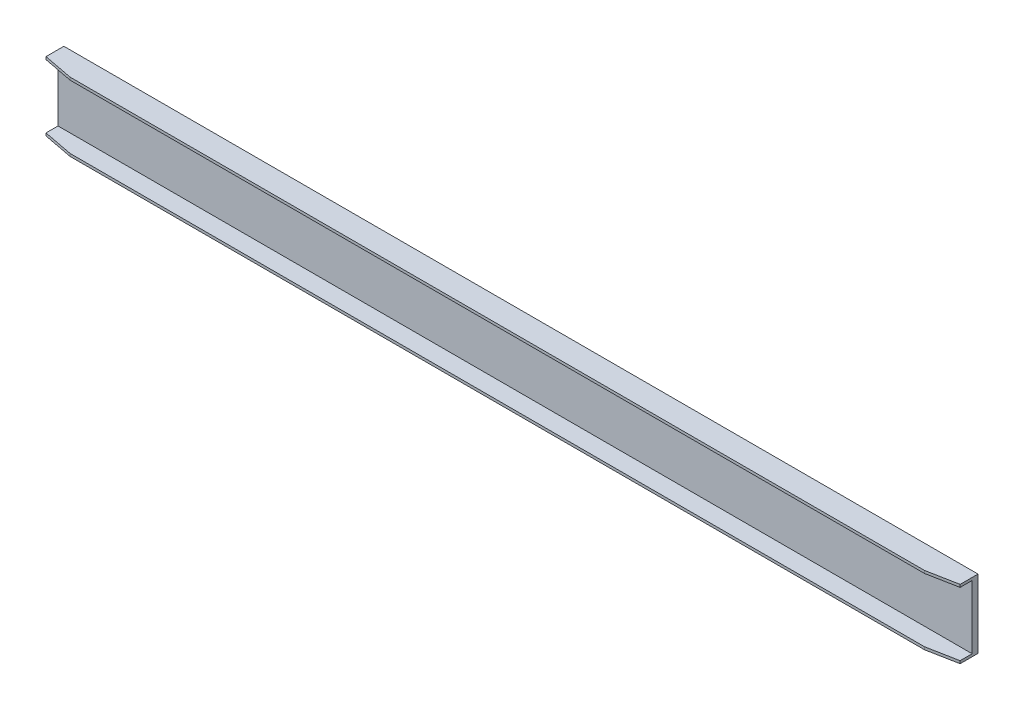
from build123d import *

# Parameters (mm, degrees)
SKETCH_1_W          = 3990
SKETCH_1_H          = 300
SKETCH_1_R          = 13
SKETCH_1_R_2        = 11.5
EXTRUDE_1608_DEPTH  = 25.5
SKETCH_2_W          = 3990
SKETCH_2_H          = 11.5
EXTRUDE_1_DEPTH     = 77.5
SKETCH_3_W          = 70
SKETCH_3_H          = 230
EXTRUDE_2_DEPTH     = 16
SKETCH_4_R          = 13
CUT_EXTRUDE_1_DEPTH = 2003.131676489
CUT_EXTRUDE_2_DEPTH = 2021.057919962
SKETCH_6_W          = 3990
SKETCH_6_H          = 277
EXTRUDE_3_DEPTH     = 25.5
SKETCH_7_W          = 70
SKETCH_7_H          = 230
EXTRUDE_4_DEPTH     = 16


with BuildPart() as part:
    # 草图1 → Extrude 1608 (new body)
    with BuildSketch(Plane.XY):
        Rectangle(SKETCH_1_W, SKETCH_1_H)
        with Locations((1940, 80)):
            Circle(SKETCH_1_R, mode=Mode.SUBTRACT)
        with Locations((1860, 80)):
            Circle(SKETCH_1_R, mode=Mode.SUBTRACT)
        with Locations((1780, 80)):
            Circle(SKETCH_1_R, mode=Mode.SUBTRACT)
        with Locations((1700, 80)):
            Circle(SKETCH_1_R, mode=Mode.SUBTRACT)
        with Locations((1540, 80)):
            Circle(SKETCH_1_R_2, mode=Mode.SUBTRACT)
        with Locations((1380, 80)):
            Circle(SKETCH_1_R_2, mode=Mode.SUBTRACT)
        with Locations((1220, 80)):
            Circle(SKETCH_1_R_2, mode=Mode.SUBTRACT)
        with Locations((1060, 80)):
            Circle(SKETCH_1_R_2, mode=Mode.SUBTRACT)
        with Locations((980, 80)):
            Circle(SKETCH_1_R_2, mode=Mode.SUBTRACT)
        with Locations((820, 80)):
            Circle(SKETCH_1_R_2, mode=Mode.SUBTRACT)
        with Locations((740, 80)):
            Circle(SKETCH_1_R_2, mode=Mode.SUBTRACT)
        with Locations((580, 80)):
            Circle(SKETCH_1_R_2, mode=Mode.SUBTRACT)
        with Locations((980, 0)):
            Circle(SKETCH_1_R_2, mode=Mode.SUBTRACT)
        with Locations((1060, 0)):
            Circle(SKETCH_1_R_2, mode=Mode.SUBTRACT)
        with Locations((820, 0)):
            Circle(SKETCH_1_R_2, mode=Mode.SUBTRACT)
        with Locations((740, 0)):
            Circle(SKETCH_1_R_2, mode=Mode.SUBTRACT)
        with Locations((580, 0)):
            Circle(SKETCH_1_R_2, mode=Mode.SUBTRACT)
        with Locations((1220, 0)):
            Circle(SKETCH_1_R_2, mode=Mode.SUBTRACT)
        with Locations((1380, 0)):
            Circle(SKETCH_1_R_2, mode=Mode.SUBTRACT)
        with Locations((1540, 0)):
            Circle(SKETCH_1_R_2, mode=Mode.SUBTRACT)
        with Locations((1700, 0)):
            Circle(SKETCH_1_R, mode=Mode.SUBTRACT)
        with Locations((1780, 0)):
            Circle(SKETCH_1_R, mode=Mode.SUBTRACT)
        with Locations((1860, 0)):
            Circle(SKETCH_1_R, mode=Mode.SUBTRACT)
        with Locations((1940, 0)):
            Circle(SKETCH_1_R, mode=Mode.SUBTRACT)
        with Locations((420, 80)):
            Circle(SKETCH_1_R_2, mode=Mode.SUBTRACT)
        with Locations((420, 0)):
            Circle(SKETCH_1_R_2, mode=Mode.SUBTRACT)
        with Locations((300, 0)):
            Circle(SKETCH_1_R_2, mode=Mode.SUBTRACT)
        with Locations((300, 80)):
            Circle(SKETCH_1_R_2, mode=Mode.SUBTRACT)
        with Locations((220, 80)):
            Circle(SKETCH_1_R_2, mode=Mode.SUBTRACT)
        with Locations((220, 0)):
            Circle(SKETCH_1_R_2, mode=Mode.SUBTRACT)
        with Locations((140, 0)):
            Circle(SKETCH_1_R, mode=Mode.SUBTRACT)
        with Locations((140, 80)):
            Circle(SKETCH_1_R, mode=Mode.SUBTRACT)
        with Locations((60, 80)):
            Circle(SKETCH_1_R, mode=Mode.SUBTRACT)
        with Locations((60, 0)):
            Circle(SKETCH_1_R, mode=Mode.SUBTRACT)
        with Locations(Location((1700, -80, 0), (0, 0, 180))):
            Circle(SKETCH_1_R, mode=Mode.SUBTRACT)
        with Locations(Location((1780, -80, 0), (0, 0, 180))):
            Circle(SKETCH_1_R, mode=Mode.SUBTRACT)
        with Locations(Location((1860, -80, 0), (0, 0, 180))):
            Circle(SKETCH_1_R, mode=Mode.SUBTRACT)
        with Locations(Location((1940, -80, 0), (0, 0, 180))):
            Circle(SKETCH_1_R, mode=Mode.SUBTRACT)
        with Locations(Location((580, -80, 0), (0, 0, 180))):
            Circle(SKETCH_1_R_2, mode=Mode.SUBTRACT)
        with Locations(Location((740, -80, 0), (0, 0, 180))):
            Circle(SKETCH_1_R_2, mode=Mode.SUBTRACT)
        with Locations(Location((820, -80, 0), (0, 0, 180))):
            Circle(SKETCH_1_R_2, mode=Mode.SUBTRACT)
        with Locations(Location((980, -80, 0), (0, 0, 180))):
            Circle(SKETCH_1_R_2, mode=Mode.SUBTRACT)
        with Locations(Location((1060, -80, 0), (0, 0, 180))):
            Circle(SKETCH_1_R_2, mode=Mode.SUBTRACT)
        with Locations(Location((1220, -80, 0), (0, 0, 180))):
            Circle(SKETCH_1_R_2, mode=Mode.SUBTRACT)
        with Locations(Location((1380, -80, 0), (0, 0, 180))):
            Circle(SKETCH_1_R_2, mode=Mode.SUBTRACT)
        with Locations(Location((1540, -80, 0), (0, 0, 180))):
            Circle(SKETCH_1_R_2, mode=Mode.SUBTRACT)
        with Locations(Location((220, -80, 0), (0, 0, 180))):
            Circle(SKETCH_1_R_2, mode=Mode.SUBTRACT)
        with Locations(Location((300, -80, 0), (0, 0, 180))):
            Circle(SKETCH_1_R_2, mode=Mode.SUBTRACT)
        with Locations(Location((420, -80, 0), (0, 0, 180))):
            Circle(SKETCH_1_R_2, mode=Mode.SUBTRACT)
        with Locations(Location((60, -80, 0), (0, 0, 180))):
            Circle(SKETCH_1_R, mode=Mode.SUBTRACT)
        with Locations(Location((140, -80, 0), (0, 0, 180))):
            Circle(SKETCH_1_R, mode=Mode.SUBTRACT)
        with Locations((-140, -80)):
            Circle(SKETCH_1_R, mode=Mode.SUBTRACT)
        with Locations((-60, -80)):
            Circle(SKETCH_1_R, mode=Mode.SUBTRACT)
        with Locations((-580, -80)):
            Circle(SKETCH_1_R_2, mode=Mode.SUBTRACT)
        with Locations((-420, -80)):
            Circle(SKETCH_1_R_2, mode=Mode.SUBTRACT)
        with Locations((-300, -80)):
            Circle(SKETCH_1_R_2, mode=Mode.SUBTRACT)
        with Locations((-220, -80)):
            Circle(SKETCH_1_R_2, mode=Mode.SUBTRACT)
        with Locations((-1540, -80)):
            Circle(SKETCH_1_R_2, mode=Mode.SUBTRACT)
        with Locations((-1380, -80)):
            Circle(SKETCH_1_R_2, mode=Mode.SUBTRACT)
        with Locations((-1220, -80)):
            Circle(SKETCH_1_R_2, mode=Mode.SUBTRACT)
        with Locations((-1060, -80)):
            Circle(SKETCH_1_R_2, mode=Mode.SUBTRACT)
        with Locations((-980, -80)):
            Circle(SKETCH_1_R_2, mode=Mode.SUBTRACT)
        with Locations((-820, -80)):
            Circle(SKETCH_1_R_2, mode=Mode.SUBTRACT)
        with Locations((-740, -80)):
            Circle(SKETCH_1_R_2, mode=Mode.SUBTRACT)
        with Locations((-1940, -80)):
            Circle(SKETCH_1_R, mode=Mode.SUBTRACT)
        with Locations((-1860, -80)):
            Circle(SKETCH_1_R, mode=Mode.SUBTRACT)
        with Locations((-1780, -80)):
            Circle(SKETCH_1_R, mode=Mode.SUBTRACT)
        with Locations((-1700, -80)):
            Circle(SKETCH_1_R, mode=Mode.SUBTRACT)
        with Locations(Location((-60, 0, 0), (0, 0, 180))):
            Circle(SKETCH_1_R, mode=Mode.SUBTRACT)
        with Locations(Location((-60, 80, 0), (0, 0, 180))):
            Circle(SKETCH_1_R, mode=Mode.SUBTRACT)
        with Locations(Location((-140, 80, 0), (0, 0, 180))):
            Circle(SKETCH_1_R, mode=Mode.SUBTRACT)
        with Locations(Location((-140, 0, 0), (0, 0, 180))):
            Circle(SKETCH_1_R, mode=Mode.SUBTRACT)
        with Locations(Location((-220, 0, 0), (0, 0, 180))):
            Circle(SKETCH_1_R_2, mode=Mode.SUBTRACT)
        with Locations(Location((-220, 80, 0), (0, 0, 180))):
            Circle(SKETCH_1_R_2, mode=Mode.SUBTRACT)
        with Locations(Location((-300, 80, 0), (0, 0, 180))):
            Circle(SKETCH_1_R_2, mode=Mode.SUBTRACT)
        with Locations(Location((-300, 0, 0), (0, 0, 180))):
            Circle(SKETCH_1_R_2, mode=Mode.SUBTRACT)
        with Locations(Location((-420, 0, 0), (0, 0, 180))):
            Circle(SKETCH_1_R_2, mode=Mode.SUBTRACT)
        with Locations(Location((-420, 80, 0), (0, 0, 180))):
            Circle(SKETCH_1_R_2, mode=Mode.SUBTRACT)
        with Locations(Location((-1940, 0, 0), (0, 0, 180))):
            Circle(SKETCH_1_R, mode=Mode.SUBTRACT)
        with Locations(Location((-1860, 0, 0), (0, 0, 180))):
            Circle(SKETCH_1_R, mode=Mode.SUBTRACT)
        with Locations(Location((-1780, 0, 0), (0, 0, 180))):
            Circle(SKETCH_1_R, mode=Mode.SUBTRACT)
        with Locations(Location((-1700, 0, 0), (0, 0, 180))):
            Circle(SKETCH_1_R, mode=Mode.SUBTRACT)
        with Locations(Location((-1540, 0, 0), (0, 0, 180))):
            Circle(SKETCH_1_R_2, mode=Mode.SUBTRACT)
        with Locations(Location((-1380, 0, 0), (0, 0, 180))):
            Circle(SKETCH_1_R_2, mode=Mode.SUBTRACT)
        with Locations(Location((-1220, 0, 0), (0, 0, 180))):
            Circle(SKETCH_1_R_2, mode=Mode.SUBTRACT)
        with Locations(Location((-580, 0, 0), (0, 0, 180))):
            Circle(SKETCH_1_R_2, mode=Mode.SUBTRACT)
        with Locations(Location((-740, 0, 0), (0, 0, 180))):
            Circle(SKETCH_1_R_2, mode=Mode.SUBTRACT)
        with Locations(Location((-820, 0, 0), (0, 0, 180))):
            Circle(SKETCH_1_R_2, mode=Mode.SUBTRACT)
        with Locations(Location((-1060, 0, 0), (0, 0, 180))):
            Circle(SKETCH_1_R_2, mode=Mode.SUBTRACT)
        with Locations(Location((-980, 0, 0), (0, 0, 180))):
            Circle(SKETCH_1_R_2, mode=Mode.SUBTRACT)
        with Locations(Location((-580, 80, 0), (0, 0, 180))):
            Circle(SKETCH_1_R_2, mode=Mode.SUBTRACT)
        with Locations(Location((-740, 80, 0), (0, 0, 180))):
            Circle(SKETCH_1_R_2, mode=Mode.SUBTRACT)
        with Locations(Location((-820, 80, 0), (0, 0, 180))):
            Circle(SKETCH_1_R_2, mode=Mode.SUBTRACT)
        with Locations(Location((-980, 80, 0), (0, 0, 180))):
            Circle(SKETCH_1_R_2, mode=Mode.SUBTRACT)
        with Locations(Location((-1060, 80, 0), (0, 0, 180))):
            Circle(SKETCH_1_R_2, mode=Mode.SUBTRACT)
        with Locations(Location((-1220, 80, 0), (0, 0, 180))):
            Circle(SKETCH_1_R_2, mode=Mode.SUBTRACT)
        with Locations(Location((-1380, 80, 0), (0, 0, 180))):
            Circle(SKETCH_1_R_2, mode=Mode.SUBTRACT)
        with Locations(Location((-1540, 80, 0), (0, 0, 180))):
            Circle(SKETCH_1_R_2, mode=Mode.SUBTRACT)
        with Locations(Location((-1700, 80, 0), (0, 0, 180))):
            Circle(SKETCH_1_R, mode=Mode.SUBTRACT)
        with Locations(Location((-1780, 80, 0), (0, 0, 180))):
            Circle(SKETCH_1_R, mode=Mode.SUBTRACT)
        with Locations(Location((-1860, 80, 0), (0, 0, 180))):
            Circle(SKETCH_1_R, mode=Mode.SUBTRACT)
        with Locations(Location((-1940, 80, 0), (0, 0, 180))):
            Circle(SKETCH_1_R, mode=Mode.SUBTRACT)
    extrude(amount=EXTRUDE_1608_DEPTH)

    # 草图2 → 凸台-拉伸1 (add)
    with BuildSketch(Plane.XY.offset(25.5)):
        with Locations((0, 144.25)):
            Rectangle(SKETCH_2_W, SKETCH_2_H)
        with Locations((0, -144.25)):
            Rectangle(SKETCH_2_W, SKETCH_2_H)
    extrude(amount=EXTRUDE_1_DEPTH)

    # 草图3 → 凸台-拉伸2 (add)
    with BuildSketch(Plane(origin=(0, 0, 0), x_dir=(-1, 0, 0), z_dir=(0, 0, -1))):
        with Locations((1300, 0)):
            Rectangle(SKETCH_3_W, SKETCH_3_H)
        with Locations((900, 0)):
            Rectangle(SKETCH_3_W, SKETCH_3_H)
        with Locations((-1300, 0)):
            Rectangle(SKETCH_3_W, SKETCH_3_H)
        with Locations((500, 0)):
            Rectangle(SKETCH_3_W, SKETCH_3_H)
        with Locations((-900, 0)):
            Rectangle(SKETCH_3_W, SKETCH_3_H)
        with Locations((-500, 0)):
            Rectangle(SKETCH_3_W, SKETCH_3_H)
    extrude(amount=EXTRUDE_2_DEPTH)

    # 草图4 → 切除-拉伸1 (cut, through all)
    with BuildSketch(Plane.XY.offset(25.5)):
        with Locations((1300, 80)):
            Circle(SKETCH_4_R)
        with Locations((900, 80)):
            Circle(SKETCH_4_R)
        with Locations((900, 0)):
            Circle(SKETCH_4_R)
        with Locations((1300, 0)):
            Circle(SKETCH_4_R)
        with Locations((900, -80)):
            Circle(SKETCH_4_R)
        with Locations((1300, -80)):
            Circle(SKETCH_4_R)
        with Locations((500, 80)):
            Circle(SKETCH_4_R)
        with Locations((500, 0)):
            Circle(SKETCH_4_R)
        with Locations((500, -80)):
            Circle(SKETCH_4_R)
        with Locations((-500, -80)):
            Circle(SKETCH_4_R)
        with Locations((-500, 0)):
            Circle(SKETCH_4_R)
        with Locations((-500, 80)):
            Circle(SKETCH_4_R)
        with Locations((-1300, -80)):
            Circle(SKETCH_4_R)
        with Locations((-900, -80)):
            Circle(SKETCH_4_R)
        with Locations((-1300, 0)):
            Circle(SKETCH_4_R)
        with Locations((-900, 0)):
            Circle(SKETCH_4_R)
        with Locations((-900, 80)):
            Circle(SKETCH_4_R)
        with Locations((-1300, 80)):
            Circle(SKETCH_4_R)
    extrude(amount=-CUT_EXTRUDE_1_DEPTH, mode=Mode.SUBTRACT)

    # 草图5 → 切除-拉伸2 (cut, through all)
    with BuildSketch(Plane(origin=(0, 150, 0), x_dir=(-1, 0, 0), z_dir=(0, 1, 0))):
        Polygon((-1995, 78), (-1995, 103), (-1865, 103), align=None)
        Polygon((1865, 103), (1995, 78), (1995, 103), align=None)
    extrude(amount=-CUT_EXTRUDE_2_DEPTH, mode=Mode.SUBTRACT)

    # 草图6 → 凸台-拉伸3 (add)
    with BuildSketch(Plane.XY.offset(25.5)):
        Rectangle(SKETCH_6_W, SKETCH_6_H)
    extrude(amount=-EXTRUDE_3_DEPTH)

    # 草图7 → 凸台-拉伸4 (add)
    with BuildSketch(Plane(origin=(0, 0, 0), x_dir=(-1, 0, 0), z_dir=(0, 0, -1))):
        with Locations((-1300, 0)):
            Rectangle(SKETCH_7_W, SKETCH_7_H)
        with Locations((-900, 0)):
            Rectangle(SKETCH_7_W, SKETCH_7_H)
        with Locations((-500, 0)):
            Rectangle(SKETCH_7_W, SKETCH_7_H)
        with Locations((500, 0)):
            Rectangle(SKETCH_7_W, SKETCH_7_H)
        with Locations((900, 0)):
            Rectangle(SKETCH_7_W, SKETCH_7_H)
        with Locations((1300, 0)):
            Rectangle(SKETCH_7_W, SKETCH_7_H)
    extrude(amount=EXTRUDE_4_DEPTH)


solid = part.part
